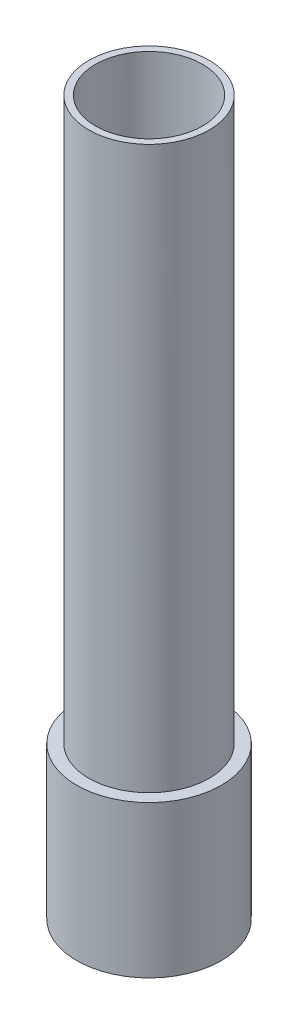
from build123d import *

# Parameters (mm, degrees)
SKETCH1_R           = 7.9375
SKETCH1_R_2         = 7.0485
BOSS_EXTRUDE1_DEPTH = 93.93
SKETCH2_R           = 9.525
SKETCH2_R_2         = 7.9375
BOSS_EXTRUDE2_DEPTH = 20
SKETCH3_R           = 8.33501
CUT_EXTRUDE1_DEPTH  = 16.086664195


with BuildPart() as part:
    # Sketch1 → Boss-Extrude1 (new body)
    with BuildSketch(Plane(origin=(0, 0, 0), x_dir=(1, 0, 0), z_dir=(0, 1, 0))):
        with Locations(Location((13.632659162, 6.079429086, 0), (0, 0, 270))):
            Circle(SKETCH1_R)
        with Locations(Location((13.632659162, 6.079429086, 0), (0, 0, 270))):
            Circle(SKETCH1_R_2, mode=Mode.SUBTRACT)
    extrude(amount=BOSS_EXTRUDE1_DEPTH)

    # Sketch2 → Boss-Extrude2 (add)
    with BuildSketch(Plane.XZ):
        with Locations(Location((13.632659162, -6.079429086, 0), (0, 0, 270))):
            Circle(SKETCH2_R)
        with Locations(Location((13.632659162, -6.079429086, 0), (0, 0, 270))):
            Circle(SKETCH2_R_2, mode=Mode.SUBTRACT)
    extrude(amount=-BOSS_EXTRUDE2_DEPTH)

    # Sketch3 → Cut-Extrude1 (cut)
    with BuildSketch(Plane.XZ):
        with Locations(Location((13.632659162, -6.079429086, 0), (0, 0, 270))):
            Circle(SKETCH3_R)
    extrude(amount=-CUT_EXTRUDE1_DEPTH, mode=Mode.SUBTRACT)


solid = part.part
